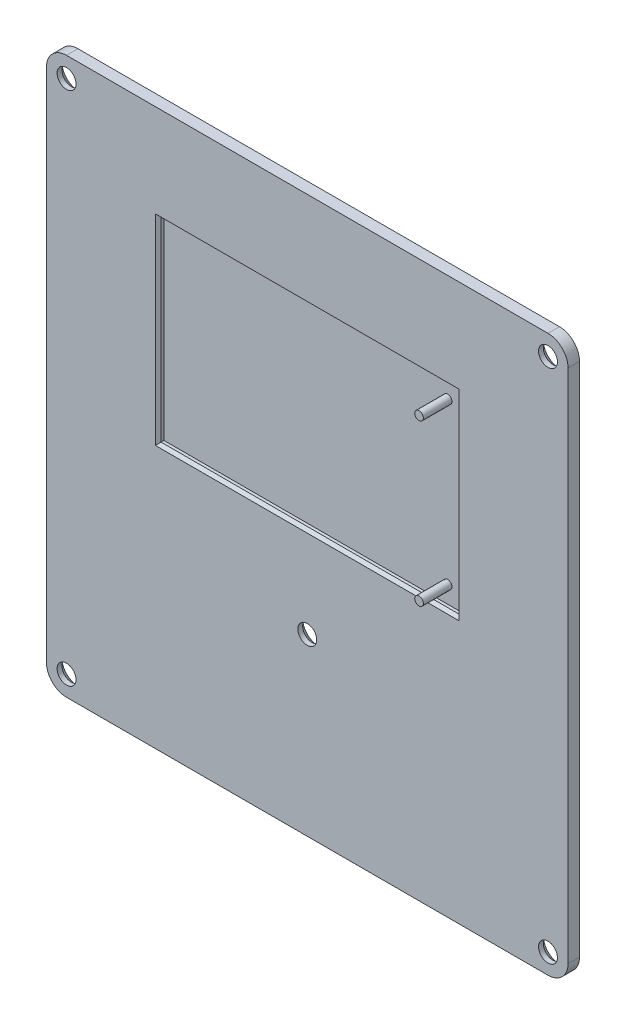
from build123d import *

# Parameters (mm, degrees)
EXTRUDE_1_DEPTH           = 2
HOLE_WIZARD_2_D           = 3.3
HOLE_WIZARD_2_DEPTH       = 15
HOLE_WIZARD_2_CSINK_D     = 5.6
HOLE_WIZARD_2_CSINK_ANGLE = 90
HOLE_WIZARD_2_TIP         = 0.991420021
SKETCH_5_W                = 0.314102564
SKETCH_5_H                = 2.557692308
EXTRUDE_3_DEPTH           = 0.2
HOLE_WIZARD_3_D           = 3.3
HOLE_WIZARD_3_DEPTH       = 15
HOLE_WIZARD_3_CSINK_D     = 5.6
HOLE_WIZARD_3_CSINK_ANGLE = 90
HOLE_WIZARD_3_TIP         = 0.991420021
SKETCH_8_W                = 52
SKETCH_8_H                = 34
CUT_EXTRUDE_1_DEPTH       = 1
CHAMFER_1_SIZE            = 0.5
SKETCH_9_R                = 0.75
EXTRUDE_4_DEPTH           = 5


with BuildPart() as part:
    # 草图1 → 凸台-拉伸1 (new body)
    with BuildSketch(Plane.XY):
        with BuildLine():
            Line((-42, 48.5), (42, 48.5))
            ThreePointArc((42, 48.5), (44.474873734, 47.474873734), (45.5, 45))
            Line((45.5, 45), (45.5, -45))
            ThreePointArc((45.5, -45), (44.474873734, -47.474873734), (42, -48.5))
            Line((42, -48.5), (-42, -48.5))
            ThreePointArc((-42, -48.5), (-44.474873734, -47.474873734), (-45.5, -45))
            Line((-45.5, -45), (-45.5, 45))
            ThreePointArc((-45.5, 45), (-44.474873734, 47.474873734), (-42, 48.5))
        make_face()
    extrude(amount=-EXTRUDE_1_DEPTH)

    # 打孔尺寸开槽半沉头螺钉的类型2
    with Locations(Plane(origin=(42, 45, -2), x_dir=(-1, 0, 0), z_dir=(0, 0, -1))):
        with Locations((0, 0), (84, 0), (84, -90), (0, -90)):
            CounterSinkHole(HOLE_WIZARD_2_D / 2, HOLE_WIZARD_2_CSINK_D / 2, depth=HOLE_WIZARD_2_DEPTH, counter_sink_angle=HOLE_WIZARD_2_CSINK_ANGLE)
            with Locations((0, 0, -(HOLE_WIZARD_2_DEPTH + HOLE_WIZARD_2_TIP / 2))):  # 118° drill point
                Cone(0, HOLE_WIZARD_2_D / 2, HOLE_WIZARD_2_TIP, mode=Mode.SUBTRACT)

    # 草图5 → 凸台-拉伸3 (add)
    # profile 1 of 6: a face of its own
    with BuildSketch(Plane(origin=(0, 0, -2), x_dir=(-1, 0, 0), z_dir=(0, 0, -1))):
        with BuildLine():
            Line((-6.136904816, 34.351745916), (-5.436484142, 34.351745916))
            add(Edge.make_bspline(
                [(-5.436484142, 34.351745916), (-5.389743014, 34.35159033), (-5.29999487, 34.351291588), (-5.171421599, 34.349625825), (-5.054594502, 34.344851469), (-4.949574663, 34.340742886), (-4.856364008, 34.333250944), (-4.774676717, 34.326090297), (-4.70488902, 34.316716636), (-4.662643168, 34.308011213), (-4.643515392, 34.304069634)],
                knots=[0, 0, 0, 0, 1.410062039, 2.707475311, 3.878576406, 4.937260626, 5.877586885, 6.699081471, 7.410979367, 8, 8, 8, 8], degree=3))
            add(Edge.make_bspline(
                [(-4.643515392, 34.304069634), (-4.617908768, 34.297742869), (-4.567241779, 34.285224305), (-4.494291713, 34.258764704), (-4.424777389, 34.22814508), (-4.358987565, 34.192181359), (-4.297251773, 34.15060658), (-4.238933463, 34.104138457), (-4.183767999, 34.053031251), (-4.133986369, 33.99599641), (-4.087047317, 33.9361599), (-4.047458691, 33.871456143), (-4.013332211, 33.803794616), (-3.986161694, 33.732487198), (-3.964283721, 33.658225426), (-3.948857481, 33.580336629), (-3.939606294, 33.499175654), (-3.938664438, 33.443817746), (-3.938186867, 33.41574832)],
                knots=[0, 0, 0, 0, 1.027469482, 2.033020251, 3.019912614, 3.986113645, 4.951240523, 5.91722682, 6.890402269, 7.87763091, 8.8651537, 9.85103654, 10.82876324, 11.815024772, 12.821070561, 13.842952187, 14.906261191, 16, 16, 16, 16], degree=3))
            add(Edge.make_bspline(
                [(-3.938186867, 33.41574832), (-3.939655865, 33.369113215), (-3.942522261, 33.278116047), (-3.969247364, 33.146055166), (-4.013023884, 33.022865851), (-4.073347173, 32.908703213), (-4.150166649, 32.805792568), (-4.24249144, 32.715402113), (-4.350373051, 32.6397622), (-4.450802367, 32.587309395), (-4.539516567, 32.553716487), (-4.61254988, 32.530080128), (-4.692216857, 32.511818163), (-4.777754192, 32.495458031), (-4.869517847, 32.483106337), (-4.967287887, 32.474059742), (-5.071134039, 32.468405693), (-5.142473108, 32.467563688), (-5.179172444, 32.467130531)],
                knots=[0, 0, 0, 0, 1.260483769, 2.459530307, 3.627416485, 4.787058657, 5.939039949, 7.08810263, 8.267026773, 9.491475466, 10.141966685, 10.831826277, 11.566392101, 12.351337768, 13.187381173, 14.07005841, 15.007169909, 16, 16, 16, 16], degree=3))
            Line((-5.179172444, 32.467130531), (-3.893315072, 30.851745916))
            Line((-3.893315072, 30.851745916), (-4.281736546, 30.851745916))
            Line((-4.281736546, 30.851745916), (-5.567593918, 32.467130531))
            Line((-5.567593918, 32.467130531), (-5.822802251, 32.467130531))
            Line((-5.822802251, 32.467130531), (-5.822802251, 30.851745916))
            Line((-5.822802251, 30.851745916), (-6.136904816, 30.851745916))
            Line((-6.136904816, 30.851745916), (-6.136904816, 34.351745916))
        make_face()
        with BuildLine():
            Line((-5.822802251, 33.992771557), (-5.822802251, 32.82610489))
            Line((-5.822802251, 32.82610489), (-5.181976931, 32.821197038))
            add(Edge.make_bspline(
                [(-5.181976931, 32.821197038), (-5.152056892, 32.821183801), (-5.094063335, 32.821158145), (-5.01016267, 32.825151921), (-4.932042558, 32.829695239), (-4.860001806, 32.836644585), (-4.794008231, 32.845600657), (-4.734094818, 32.856803641), (-4.680163766, 32.869855703), (-4.617265227, 32.890057329), (-4.547028696, 32.922063348), (-4.470697236, 32.968628846), (-4.405694898, 33.027197965), (-4.350777036, 33.094171421), (-4.306647605, 33.16780767), (-4.27553555, 33.247224039), (-4.255793108, 33.330415637), (-4.253464563, 33.387593745), (-4.252289431, 33.416449442)],
                knots=[0, 0, 0, 0, 1.146690395, 2.22261258, 3.21895312, 4.145990853, 4.996080663, 5.770904154, 6.481378293, 7.121626537, 8.300444488, 9.431385265, 10.535395872, 11.636531494, 12.74115979, 13.810798291, 14.895190096, 16, 16, 16, 16], degree=3))
            add(Edge.make_bspline(
                [(-4.252289431, 33.416449442), (-4.253491552, 33.444596015), (-4.255873717, 33.500372254), (-4.275322486, 33.582028164), (-4.308211867, 33.659095115), (-4.352534105, 33.7312596), (-4.40653326, 33.796765335), (-4.469851073, 33.852812488), (-4.540756268, 33.899061953), (-4.607027466, 33.928616334), (-4.666261679, 33.946736187), (-4.717691339, 33.959487351), (-4.775802817, 33.96973182), (-4.840878275, 33.97793988), (-4.912639906, 33.984994825), (-4.991450557, 33.989746603), (-5.076787337, 33.992560468), (-5.135934269, 33.992699556), (-5.166552251, 33.992771557)],
                knots=[0, 0, 0, 0, 1.101028733, 2.181837193, 3.264309656, 4.369019818, 5.486613113, 6.575447106, 7.666700264, 8.788928104, 9.402425223, 10.0903467, 10.862060571, 11.710948788, 12.657782767, 13.684531032, 14.801375019, 16, 16, 16, 16], degree=3))
            Line((-5.166552251, 33.992771557), (-5.822802251, 33.992771557))
        make_face(mode=Mode.SUBTRACT)
    # profile 2 of 6: a face of its own
    with BuildSketch(Plane(origin=(0, 0, -2), x_dir=(-1, 0, 0), z_dir=(0, 0, -1))):
        with BuildLine():
            Line((-3.309981739, 33.409438224), (-2.995879175, 33.409438224))
            Line((-2.995879175, 33.409438224), (-2.995879175, 32.223140147))
            add(Edge.make_bspline(
                [(-2.995879175, 32.223140147), (-2.99573727, 32.188317398), (-2.995465812, 32.12170311), (-2.993624871, 32.025847923), (-2.989294778, 31.93843121), (-2.983880953, 31.859402473), (-2.976918817, 31.788775082), (-2.968635457, 31.726795725), (-2.959377035, 31.672761541), (-2.950314321, 31.640218185), (-2.946099527, 31.625083256)],
                knots=[0, 0, 0, 0, 1.388932606, 2.656963016, 3.823490214, 4.879454478, 5.816252168, 6.653371382, 7.373723809, 8, 8, 8, 8], degree=3))
            add(Edge.make_bspline(
                [(-2.946099527, 31.625083256), (-2.939338072, 31.606060385), (-2.925955731, 31.568410124), (-2.901682247, 31.514021119), (-2.871653911, 31.463645836), (-2.838794083, 31.415341763), (-2.800894675, 31.370539777), (-2.758435204, 31.329315533), (-2.712836967, 31.290111442), (-2.645081944, 31.24372665), (-2.552422678, 31.19401132), (-2.430769922, 31.151115501), (-2.298865697, 31.125479681), (-2.207700977, 31.122505426), (-2.160843117, 31.120976685)],
                knots=[0, 0, 0, 0, 0.725840625, 1.436591201, 2.137033971, 2.831655856, 3.53531722, 4.242432219, 4.957935707, 5.694543706, 7.190802206, 8.724350549, 10.316345118, 12, 12, 12, 12], degree=3))
            add(Edge.make_bspline(
                [(-2.160843117, 31.120976685), (-2.113989609, 31.122537934), (-2.023336741, 31.125558661), (-1.892881772, 31.1503422), (-1.773630357, 31.191747889), (-1.666779406, 31.2495553), (-1.572813566, 31.320297363), (-1.494509147, 31.403306172), (-1.429901892, 31.495955559), (-1.401692472, 31.565079838), (-1.387505777, 31.599842871)],
                knots=[0, 0, 0, 0, 1.157059328, 2.238695713, 3.266970494, 4.264342957, 5.228770407, 6.160125903, 7.074715775, 8, 8, 8, 8], degree=3))
            add(Edge.make_bspline(
                [(-1.387505777, 31.599842871), (-1.383311547, 31.61380917), (-1.374039129, 31.644685245), (-1.364076777, 31.697064994), (-1.355102316, 31.759529598), (-1.347439139, 31.832487807), (-1.341973977, 31.915748959), (-1.33902795, 32.009287035), (-1.335699675, 32.112808396), (-1.335649159, 32.185276155), (-1.335622764, 32.223140147)],
                knots=[0, 0, 0, 0, 0.557542046, 1.232589297, 2.036731608, 2.971723315, 4.038036528, 5.22795436, 6.551621927, 8, 8, 8, 8], degree=3))
            Line((-1.335622764, 32.223140147), (-1.335622764, 33.409438224))
            Line((-1.335622764, 33.409438224), (-1.0215202, 33.409438224))
            Line((-1.0215202, 33.409438224), (-1.0215202, 32.164245916))
            add(Edge.make_bspline(
                [(-1.0215202, 32.164245916), (-1.021961895, 32.121938745), (-1.022818843, 32.039857045), (-1.028326187, 31.920572933), (-1.0377758, 31.809410688), (-1.052118484, 31.706311468), (-1.068984159, 31.611353987), (-1.090740432, 31.524416541), (-1.11671867, 31.445766987), (-1.146024185, 31.37402521), (-1.180646052, 31.308978316), (-1.217473073, 31.247242499), (-1.259997845, 31.190349564), (-1.304768079, 31.135467427), (-1.354569735, 31.085325899), (-1.408469594, 31.038774423), (-1.465709014, 30.995101392), (-1.527558212, 30.956010112), (-1.593114275, 30.920793467), (-1.662458132, 30.889577389), (-1.73643913, 30.864874812), (-1.814102767, 30.843564146), (-1.895829546, 30.826849677), (-1.981540679, 30.81506311), (-2.071207295, 30.807837779), (-2.132316755, 30.807200734), (-2.163647604, 30.806874121)],
                knots=[0, 0, 0, 0, 1.493040784, 2.896703357, 4.213163133, 5.428574705, 6.569057535, 7.615249723, 8.588095153, 9.490268104, 10.346124644, 11.18633936, 12.024365274, 12.850166724, 13.684164916, 14.514361689, 15.362232829, 16.222528818, 17.093394965, 17.986930858, 18.902426812, 19.842810585, 20.827885679, 21.843828298, 22.894529745, 24, 24, 24, 24], degree=3))
            add(Edge.make_bspline(
                [(-2.163647604, 30.806874121), (-2.194744118, 30.807213828), (-2.255851663, 30.807881385), (-2.345522907, 30.815023192), (-2.431471514, 30.826831363), (-2.513391912, 30.84368658), (-2.59136631, 30.86472565), (-2.665710549, 30.889729186), (-2.735554112, 30.920809667), (-2.801736116, 30.955787225), (-2.863738505, 30.9953525), (-2.921847083, 31.03872054), (-2.975983935, 31.085826603), (-3.026161003, 31.13647396), (-3.07167398, 31.191290896), (-3.113090022, 31.249836457), (-3.151046727, 31.311530545), (-3.185399517, 31.377593708), (-3.214911273, 31.450165718), (-3.240966519, 31.530462815), (-3.262277157, 31.619365331), (-3.279619625, 31.71679726), (-3.293571066, 31.822292302), (-3.303257208, 31.936460717), (-3.308673039, 32.059024409), (-3.3095361, 32.143674299), (-3.309981739, 32.187382935)],
                knots=[0, 0, 0, 0, 1.083640291, 2.129454052, 3.13281866, 4.105697902, 5.042300162, 5.946461698, 6.836384745, 7.703652036, 8.553297018, 9.397182691, 10.228592656, 11.052265423, 11.879314572, 12.708807002, 13.549817954, 14.402308542, 15.300838682, 16.27712199, 17.341985831, 18.484375296, 19.725102775, 21.0496083, 22.476576903, 24, 24, 24, 24], degree=3))
            Line((-3.309981739, 32.187382935), (-3.309981739, 33.409438224))
        make_face()
    # profile 3 of 6: a face of its own
    with BuildSketch(Plane(origin=(0, 0, -2), x_dir=(-1, 0, 0), z_dir=(0, 0, -1))):
        with BuildLine():
            add(Edge.make_bspline(
                [(-0.192794239, 34.486361301), (-0.173302923, 34.485457148), (-0.135135183, 34.483686644), (-0.079941915, 34.468525167), (-0.029684903, 34.442825482), (0.01489283, 34.408345801), (0.053144716, 34.367796357), (0.079925427, 34.320535389), (0.097137823, 34.26947675), (0.099216378, 34.233861661), (0.100274672, 34.215728288)],
                knots=[0, 0, 0, 0, 1.055194115, 2.066272739, 3.074728998, 4.095836921, 5.109056067, 6.073838105, 7.019297344, 8, 8, 8, 8], degree=3))
            add(Edge.make_bspline(
                [(0.100274672, 34.215728288), (0.099192512, 34.198065635), (0.09705321, 34.16314866), (0.079938722, 34.112975188), (0.052916484, 34.066370904), (0.014917358, 34.025900194), (-0.029691403, 33.991439574), (-0.079940189, 33.965734835), (-0.135135637, 33.950574698), (-0.173303076, 33.948804009), (-0.192794239, 33.947899762)],
                knots=[0, 0, 0, 0, 0.96129708, 1.900370562, 2.859976407, 3.87933698, 4.906634145, 5.921202961, 6.938410037, 8, 8, 8, 8], degree=3))
            add(Edge.make_bspline(
                [(-0.192794239, 33.947899762), (-0.212062514, 33.948769482), (-0.249565694, 33.950462279), (-0.303932536, 33.966032297), (-0.353761026, 33.99144837), (-0.398425698, 34.025674555), (-0.435655891, 34.066619452), (-0.462754217, 34.112946746), (-0.479829179, 34.163155901), (-0.481973807, 34.198068067), (-0.483058662, 34.215728288)],
                knots=[0, 0, 0, 0, 1.054934014, 2.053291228, 3.073705704, 4.106921865, 5.123545215, 6.088680038, 7.033164197, 8, 8, 8, 8], degree=3))
            add(Edge.make_bspline(
                [(-0.483058662, 34.215728288), (-0.481997575, 34.233859137), (-0.479913534, 34.26946927), (-0.462741418, 34.320564303), (-0.43588161, 34.367545805), (-0.398401047, 34.408571304), (-0.353767586, 34.442816739), (-0.303930841, 34.46822772), (-0.249566142, 34.48379906), (-0.212062666, 34.485491674), (-0.192794239, 34.486361301)],
                knots=[0, 0, 0, 0, 0.98631895, 1.937192651, 2.907499808, 3.917963147, 4.944918757, 5.95915025, 6.951458133, 8, 8, 8, 8], degree=3))
        make_face()
    # profile 4 of 6: a face of its own
    with BuildSketch(Plane(origin=(0, 0, -2), x_dir=(-1, 0, 0), z_dir=(0, 0, -1))):
        with Locations((-0.191391995, 32.13059207)):
            Rectangle(SKETCH_5_W, SKETCH_5_H)
    # profile 5 of 6: a face of its own
    with BuildSketch(Plane(origin=(0, 0, -2), x_dir=(-1, 0, 0), z_dir=(0, 0, -1))):
        with BuildLine():
            Line((2.972069543, 33.409438224), (3.286172108, 33.409438224))
            Line((3.286172108, 33.409438224), (3.286172108, 31.379690628))
            add(Edge.make_bspline(
                [(3.286172108, 31.379690628), (3.285895065, 31.336453033), (3.285360306, 31.25299406), (3.281509335, 31.132315781), (3.273388658, 31.020849695), (3.264179976, 30.918087437), (3.25093326, 30.824505326), (3.234756893, 30.739824122), (3.216521214, 30.663962559), (3.200500996, 30.617237718), (3.192922909, 30.595135339)],
                knots=[0, 0, 0, 0, 1.307562039, 2.523909702, 3.650326591, 4.686913197, 5.643429486, 6.506965704, 7.293745905, 8, 8, 8, 8], degree=3))
            add(Edge.make_bspline(
                [(3.192922909, 30.595135339), (3.18173367, 30.566405418), (3.159689744, 30.509804581), (3.11840411, 30.42957026), (3.072170207, 30.35402387), (3.019363456, 30.283586419), (2.960222652, 30.218611506), (2.89614116, 30.157687507), (2.825870968, 30.10210334), (2.749452256, 30.052818042), (2.668646623, 30.008430988), (2.583500521, 29.969984421), (2.494494082, 29.936497577), (2.400791191, 29.911414781), (2.303860956, 29.889680061), (2.202563525, 29.875535375), (2.097490729, 29.865908317), (2.026045348, 29.865018084), (1.989797909, 29.864566429)],
                knots=[0, 0, 0, 0, 0.981931301, 1.934503488, 2.87077864, 3.801706999, 4.735015492, 5.667491629, 6.616593066, 7.585388521, 8.561939025, 9.551802639, 10.560317337, 11.588439944, 12.640189604, 13.723962949, 14.845264515, 16, 16, 16, 16], degree=3))
            add(Edge.make_bspline(
                [(1.989797909, 29.864566429), (1.936913174, 29.865422915), (1.833615079, 29.867095862), (1.683010086, 29.886586777), (1.539975366, 29.91414115), (1.40640091, 29.955846577), (1.283130813, 30.006883567), (1.171006937, 30.06547852), (1.07103583, 30.132667829), (0.980912157, 30.20916843), (0.899570567, 30.300132111), (0.823043277, 30.407330956), (0.749382335, 30.532397845), (0.706213697, 30.624190558), (0.683608005, 30.672258737)],
                knots=[0, 0, 0, 0, 1.157897085, 2.2616841, 3.32207898, 4.345638746, 5.321241055, 6.241986252, 7.112515963, 7.955008012, 8.825025602, 9.77857164, 10.836726669, 12, 12, 12, 12], degree=3))
            Line((0.683608005, 30.672258737), (0.997710569, 30.672258737))
            add(Edge.make_bspline(
                [(0.997710569, 30.672258737), (1.022972778, 30.632152861), (1.072357287, 30.553750812), (1.164705768, 30.452237656), (1.265912094, 30.365484292), (1.379391777, 30.295573518), (1.505616993, 30.242863726), (1.644663679, 30.20528843), (1.797663301, 30.182792163), (1.904181515, 30.180080869), (1.959649672, 30.178668993)],
                knots=[0, 0, 0, 0, 0.997731894, 1.950442991, 2.880492273, 3.800895997, 4.748200782, 5.754801363, 6.83083817, 8, 8, 8, 8], degree=3))
            add(Edge.make_bspline(
                [(1.959649672, 30.178668993), (2.014416562, 30.180099142), (2.120001645, 30.182856326), (2.271832814, 30.20529847), (2.410427752, 30.242871903), (2.534987952, 30.29548029), (2.644043721, 30.359930696), (2.738055712, 30.431930771), (2.814200388, 30.513111774), (2.865413355, 30.58789358), (2.897247973, 30.654517709), (2.917520209, 30.711870305), (2.933994179, 30.776723183), (2.947774016, 30.848858919), (2.95914493, 30.928380576), (2.966347812, 31.01546998), (2.971553624, 31.109929202), (2.971893593, 31.17542234), (2.972069543, 31.209318031)],
                knots=[0, 0, 0, 0, 1.570740765, 3.028230971, 4.391408896, 5.680370741, 6.894727393, 8.017376726, 9.065722033, 10.075533815, 10.603371122, 11.180248986, 11.817768598, 12.521299649, 13.286540596, 14.121245857, 15.027658897, 16, 16, 16, 16], degree=3))
            Line((2.972069543, 31.209318031), (2.972069543, 31.341830051))
            add(Edge.make_bspline(
                [(2.972069543, 31.341830051), (2.940188426, 31.303888249), (2.87698697, 31.228672029), (2.767839643, 31.130110392), (2.648622728, 31.045224262), (2.519539185, 30.975605627), (2.383750943, 30.919924203), (2.242728713, 30.880981242), (2.097736657, 30.855821342), (1.999484508, 30.853114026), (1.949833966, 30.851745916)],
                knots=[0, 0, 0, 0, 1.012485704, 2.007162095, 2.997754123, 3.998611389, 4.999708251, 5.992315798, 6.98544096, 8, 8, 8, 8], degree=3))
            add(Edge.make_bspline(
                [(1.949833966, 30.851745916), (1.920597697, 30.852260943), (1.86247114, 30.853284901), (1.776116392, 30.862243678), (1.691035954, 30.87524242), (1.60742825, 30.894323859), (1.525172637, 30.918815586), (1.444405045, 30.949432325), (1.364471519, 30.984047443), (1.286825021, 31.024820246), (1.21223889, 31.070182553), (1.141275705, 31.119321444), (1.074307166, 31.171979732), (1.011970676, 31.228676672), (0.954348005, 31.289330205), (0.900664137, 31.353293758), (0.85180679, 31.421460499), (0.8067734, 31.492587457), (0.76771585, 31.56714838), (0.733431478, 31.643526476), (0.703622073, 31.72155843), (0.679856672, 31.801505493), (0.661705558, 31.883317262), (0.648195331, 31.966859711), (0.6405324, 32.052390098), (0.639337476, 32.110011448), (0.63873621, 32.139005531)],
                knots=[0, 0, 0, 0, 1.028754217, 2.045334182, 3.052854819, 4.056607503, 5.061168794, 6.071104265, 7.095078842, 8.125279047, 9.155117945, 10.165957491, 11.161587969, 12.151493252, 13.128948131, 14.104219989, 15.088194871, 16.07871515, 17.064853787, 18.047899887, 19.02414258, 20.002704429, 20.980574569, 21.971845993, 22.979467364, 24, 24, 24, 24], degree=3))
            add(Edge.make_bspline(
                [(0.63873621, 32.139005531), (0.639255376, 32.168008627), (0.640291698, 32.225902486), (0.649242677, 32.311781872), (0.662010867, 32.396511307), (0.682218636, 32.479217449), (0.706541158, 32.5608422), (0.736664731, 32.640782657), (0.77288349, 32.719063166), (0.81389324, 32.795741697), (0.859977333, 32.869789312), (0.910509813, 32.940115958), (0.965551688, 33.00620413), (1.024343603, 33.068720552), (1.08760342, 33.127062045), (1.155298413, 33.18108701), (1.226761293, 33.231701036), (1.302213543, 33.277812373), (1.380490931, 33.31859462), (1.459604749, 33.355807217), (1.540602984, 33.385341336), (1.621975524, 33.411364435), (1.705155438, 33.429799631), (1.789122832, 33.444021873), (1.87416517, 33.452686594), (1.931118065, 33.453768179), (1.959649672, 33.454310019)],
                knots=[0, 0, 0, 0, 1.008818848, 2.013730394, 3.001654427, 3.987803273, 4.973046549, 5.963777569, 6.957074694, 7.972068341, 8.987420212, 9.989399531, 10.982630087, 11.977756091, 12.973280677, 13.973972381, 14.989194003, 16.018387222, 17.047741039, 18.059210846, 19.057554164, 20.045176975, 21.029480261, 22.018708529, 23.007435371, 24, 24, 24, 24], degree=3))
            add(Edge.make_bspline(
                [(1.959649672, 33.454310019), (2.006700611, 33.452953345), (2.099611758, 33.450274332), (2.23634276, 33.429253187), (2.368285, 33.395739174), (2.496183016, 33.347723543), (2.621078667, 33.282173505), (2.742560322, 33.195830557), (2.860979456, 33.087920217), (2.934057287, 33.005167353), (2.972069543, 32.962122519)],
                knots=[0, 0, 0, 0, 0.96728863, 1.910097829, 2.838038873, 3.762875196, 4.71315279, 5.730631239, 6.819562287, 8, 8, 8, 8], degree=3))
            Line((2.972069543, 32.962122519), (2.972069543, 33.409438224))
        make_face()
        with BuildLine():
            add(Edge.make_bspline(
                [(1.984890056, 33.140207455), (1.938959352, 33.138646389), (1.848026298, 33.13555581), (1.714737955, 33.109171097), (1.586061022, 33.067825197), (1.464455594, 33.008682582), (1.350548484, 32.936588344), (1.249473663, 32.849248056), (1.161068747, 32.749501859), (1.086285809, 32.638251612), (1.026754443, 32.518229337), (0.984611023, 32.391718603), (0.957361, 32.26076361), (0.954353348, 32.171391007), (0.952838774, 32.126385339)],
                knots=[0, 0, 0, 0, 1.026226791, 2.031711442, 3.026614839, 4.04107745, 5.047145931, 6.032893242, 7.017642609, 8.019221815, 9.021877557, 10.003543541, 10.994637589, 12, 12, 12, 12], degree=3))
            add(Edge.make_bspline(
                [(0.952838774, 32.126385339), (0.953564531, 32.092452067), (0.954991882, 32.025715243), (0.96871546, 31.927777348), (0.990896425, 31.834497034), (1.022333632, 31.74586866), (1.061286327, 31.661383865), (1.110278698, 31.58162463), (1.167929669, 31.506519924), (1.233788007, 31.436625242), (1.306364389, 31.372964274), (1.385083588, 31.317026233), (1.469838838, 31.271275512), (1.558545648, 31.231734675), (1.653356404, 31.202855607), (1.75290549, 31.180816828), (1.857897187, 31.16820807), (1.929468926, 31.166645272), (1.965959768, 31.16584848)],
                knots=[0, 0, 0, 0, 1.039728707, 2.044842319, 3.024901384, 3.974314358, 4.923051295, 5.871625912, 6.837440708, 7.820715446, 8.810779094, 9.792721783, 10.773906224, 11.758876063, 12.764959493, 13.806266761, 14.881525401, 16, 16, 16, 16], degree=3))
            add(Edge.make_bspline(
                [(1.965959768, 31.16584848), (2.002923526, 31.166616089), (2.075205763, 31.168117141), (2.1807767, 31.181020639), (2.28080944, 31.201842615), (2.375212263, 31.231405641), (2.464341604, 31.269127391), (2.547196218, 31.316864009), (2.625552666, 31.371228441), (2.696909076, 31.434640455), (2.761433241, 31.50452545), (2.817664008, 31.580570345), (2.865578457, 31.661630864), (2.905256127, 31.74769787), (2.935547331, 31.839440223), (2.955866236, 31.936628579), (2.970072981, 32.038797318), (2.971393906, 32.108805934), (2.972069543, 32.144614506)],
                knots=[0, 0, 0, 0, 1.121943988, 2.193949579, 3.223793937, 4.220241907, 5.192961521, 6.155822191, 7.11847367, 8.083710714, 9.04790392, 10.001595906, 10.949595423, 11.902125208, 12.873731292, 13.87582262, 14.913508608, 16, 16, 16, 16], degree=3))
            add(Edge.make_bspline(
                [(2.972069543, 32.144614506), (2.970729975, 32.19123236), (2.96811293, 32.282307265), (2.943415772, 32.415014033), (2.903595562, 32.539782707), (2.84774881, 32.656218682), (2.777766801, 32.763088232), (2.693475952, 32.858412077), (2.596329922, 32.942312933), (2.486607821, 33.012211127), (2.368560376, 33.068676561), (2.24503918, 33.111038333), (2.116227616, 33.135032648), (2.028921207, 33.138472592), (1.984890056, 33.140207455)],
                knots=[0, 0, 0, 0, 1.070913519, 2.092188694, 3.091357305, 4.074328408, 5.051968682, 6.018948707, 6.99050112, 7.9935919, 9.000589572, 9.992915277, 10.987769056, 12, 12, 12, 12], degree=3))
        make_face(mode=Mode.SUBTRACT)
    # profile 6 of 6: a face of its own
    with BuildSketch(Plane(origin=(0, 0, -2), x_dir=(-1, 0, 0), z_dir=(0, 0, -1))):
        with BuildLine():
            Line((6.103279479, 31.659438224), (6.382325954, 31.512903769))
            add(Edge.make_bspline(
                [(6.382325954, 31.512903769), (6.360089358, 31.473460437), (6.31682575, 31.396719335), (6.242425002, 31.291287474), (6.164432929, 31.196439758), (6.079328961, 31.114710104), (5.989659283, 31.043458719), (5.894926628, 30.981120894), (5.79463781, 30.928002374), (5.688788085, 30.883249846), (5.576488534, 30.848840352), (5.457467018, 30.824536131), (5.331495522, 30.809512862), (5.245149342, 30.807767722), (5.200935729, 30.806874121)],
                knots=[0, 0, 0, 0, 1.120438281, 2.179929193, 3.190490725, 4.156257408, 5.095198341, 6.022838206, 6.959905092, 7.901321166, 8.864066838, 9.862729781, 10.905609505, 12, 12, 12, 12], degree=3))
            add(Edge.make_bspline(
                [(5.200935729, 30.806874121), (5.151793752, 30.808021297), (5.05593199, 30.810259103), (4.916392243, 30.829551568), (4.785012825, 30.861023926), (4.661801121, 30.904989468), (4.547058869, 30.962416792), (4.440558014, 31.032376274), (4.341738488, 31.114508528), (4.253714279, 31.209524972), (4.174470396, 31.311206929), (4.104544576, 31.417162814), (4.046087145, 31.527126038), (3.998534535, 31.640396562), (3.96012967, 31.756260456), (3.933362966, 31.875771923), (3.917933218, 31.998607508), (3.915568773, 32.081704843), (3.914377236, 32.123580852)],
                knots=[0, 0, 0, 0, 1.145258523, 2.234067595, 3.276747158, 4.290159414, 5.277019952, 6.260822364, 7.254936242, 8.264827045, 9.274100331, 10.257902744, 11.220704747, 12.172965371, 13.118907548, 14.062713208, 15.023725156, 16, 16, 16, 16], degree=3))
            add(Edge.make_bspline(
                [(3.914377236, 32.123580852), (3.915436377, 32.162875682), (3.917535455, 32.240752847), (3.930766243, 32.356018392), (3.954214536, 32.468046844), (3.98639086, 32.576931292), (4.027942106, 32.682489426), (4.078774325, 32.78478549), (4.138966703, 32.88371063), (4.185439377, 32.946113763), (4.20884839, 32.977547198)],
                knots=[0, 0, 0, 0, 1.024358464, 2.0301432, 3.019427413, 4.004406732, 4.986367066, 5.972626655, 6.978780325, 8, 8, 8, 8], degree=3))
            add(Edge.make_bspline(
                [(4.20884839, 32.977547198), (4.240556072, 33.015416068), (4.302967019, 33.089954219), (4.408523374, 33.187892544), (4.522823571, 33.26993632), (4.644435197, 33.337943456), (4.774771671, 33.389617103), (4.912080962, 33.428124685), (5.057926548, 33.449702696), (5.157631769, 33.45275053), (5.208648069, 33.454310019)],
                knots=[0, 0, 0, 0, 1.030682036, 2.02871468, 2.997146059, 3.962720338, 4.930598197, 5.918074684, 6.934738563, 8, 8, 8, 8], degree=3))
            add(Edge.make_bspline(
                [(5.208648069, 33.454310019), (5.261095674, 33.45295597), (5.36398592, 33.450299634), (5.514018041, 33.425673301), (5.655978758, 33.386620747), (5.789811262, 33.331466956), (5.915529123, 33.260307404), (6.032315173, 33.172165563), (6.142166685, 33.069747476), (6.206075264, 32.990984266), (6.238595986, 32.95090457)],
                knots=[0, 0, 0, 0, 1.056321875, 2.072262726, 3.055038591, 4.01806755, 4.982017516, 5.957941055, 6.960871419, 8, 8, 8, 8], degree=3))
            add(Edge.make_bspline(
                [(6.238595986, 32.95090457), (6.260722924, 32.920700989), (6.304829517, 32.86049487), (6.360076617, 32.762323713), (6.408034012, 32.659613118), (6.446366973, 32.550702821), (6.477406474, 32.436883241), (6.499863293, 32.317340696), (6.513032912, 32.192110785), (6.515621609, 32.10678423), (6.516941338, 32.063284378)],
                knots=[0, 0, 0, 0, 0.94817472, 1.890038105, 2.849395472, 3.817997239, 4.812318967, 5.836947057, 6.897266129, 8, 8, 8, 8], degree=3))
            Line((6.516941338, 32.063284378), (4.2284798, 32.063284378))
            add(Edge.make_bspline(
                [(4.2284798, 32.063284378), (4.230019406, 32.029583913), (4.23304698, 31.96331331), (4.247162123, 31.866342527), (4.269410897, 31.773969184), (4.30067996, 31.686886142), (4.338546805, 31.603956015), (4.384932522, 31.525793978), (4.440272076, 31.452756048), (4.501997775, 31.38418891), (4.57070487, 31.323128149), (4.642987618, 31.268476373), (4.719881183, 31.222670776), (4.800779266, 31.185490886), (4.885551051, 31.15638457), (4.974223246, 31.13651675), (5.066621363, 31.123209643), (5.129607097, 31.121729978), (5.161672909, 31.120976685)],
                knots=[0, 0, 0, 0, 1.094153842, 2.151609401, 3.174256925, 4.172055639, 5.149267565, 6.128595816, 7.11444997, 8.118368179, 9.117203808, 10.09244225, 11.054858984, 12.015122123, 12.976791628, 13.957293641, 14.960065497, 16, 16, 16, 16], degree=3))
            add(Edge.make_bspline(
                [(5.161672909, 31.120976685), (5.193024056, 31.121584742), (5.255230747, 31.122791243), (5.347871605, 31.134523154), (5.439011132, 31.15349343), (5.528272115, 31.17938342), (5.613842961, 31.210960272), (5.693088511, 31.249063129), (5.765968727, 31.291212876), (5.834085694, 31.339422551), (5.900156687, 31.398430738), (5.965699173, 31.472066459), (6.035975827, 31.559153987), (6.079965419, 31.624699653), (6.103279479, 31.659438224)],
                knots=[0, 0, 0, 0, 0.99110716, 1.966546729, 2.947904876, 3.932708344, 4.903319531, 5.828989031, 6.710028674, 7.56322171, 8.463672341, 9.504779593, 10.677557249, 12, 12, 12, 12], degree=3))
        make_face()
        with BuildLine():
            add(Edge.make_bspline(
                [(6.202838774, 32.377386942), (6.19134215, 32.419049815), (6.169214848, 32.499237436), (6.122978484, 32.610278326), (6.070906943, 32.708966227), (6.009285212, 32.794545861), (5.939466486, 32.870549374), (5.858821303, 32.936967959), (5.76838541, 32.99638541), (5.668626269, 33.046537909), (5.562984484, 33.089227768), (5.452378292, 33.117852884), (5.339520504, 33.137462426), (5.263186218, 33.139288534), (5.22477387, 33.140207455)],
                knots=[0, 0, 0, 0, 1.154881502, 2.222775134, 3.210006277, 4.132804581, 5.035138423, 5.962687519, 6.919655026, 7.923214229, 8.944639381, 9.960483929, 10.97369054, 12, 12, 12, 12], degree=3))
            add(Edge.make_bspline(
                [(5.22477387, 33.140207455), (5.193424432, 33.139595783), (5.131453183, 33.138386637), (5.040152115, 33.126916508), (4.952472416, 33.107956663), (4.867767128, 33.081991706), (4.78714626, 33.047383104), (4.708951491, 33.006799877), (4.635171095, 32.957258293), (4.5890298, 32.919499438), (4.565719383, 32.900423801)],
                knots=[0, 0, 0, 0, 1.04873581, 2.073130211, 3.073294108, 4.04793562, 5.032784715, 6.005352987, 6.992311501, 8, 8, 8, 8], degree=3))
            add(Edge.make_bspline(
                [(4.565719383, 32.900423801), (4.549026101, 32.885329485), (4.515242967, 32.854782269), (4.470102445, 32.802153062), (4.426881973, 32.7454015), (4.38754832, 32.682356376), (4.351470734, 32.613735597), (4.317710756, 32.540117961), (4.287324344, 32.460944831), (4.270228234, 32.405772392), (4.261432524, 32.377386942)],
                knots=[0, 0, 0, 0, 0.879870761, 1.780643979, 2.707998968, 3.669668524, 4.684282772, 5.740141944, 6.837334558, 8, 8, 8, 8], degree=3))
            Line((4.261432524, 32.377386942), (6.202838774, 32.377386942))
        make_face(mode=Mode.SUBTRACT)
    extrude(amount=EXTRUDE_3_DEPTH)

    # 打孔尺寸开槽半沉头螺钉的类型3
    with Locations(Plane(origin=(0, -18, -2), x_dir=(-1, 0, 0), z_dir=(0, 0, -1))):
        with Locations((0, 0)):
            CounterSinkHole(HOLE_WIZARD_3_D / 2, HOLE_WIZARD_3_CSINK_D / 2, depth=HOLE_WIZARD_3_DEPTH, counter_sink_angle=HOLE_WIZARD_3_CSINK_ANGLE)
            with Locations((0, 0, -(HOLE_WIZARD_3_DEPTH + HOLE_WIZARD_3_TIP / 2))):  # 118° drill point
                Cone(0, HOLE_WIZARD_3_D / 2, HOLE_WIZARD_3_TIP, mode=Mode.SUBTRACT)

    # 草图8 → 切除-拉伸1 (cut)
    with BuildSketch(Plane.XY):
        with Locations((0, 14.808401639)):
            Rectangle(SKETCH_8_W, SKETCH_8_H)
    extrude(amount=-CUT_EXTRUDE_1_DEPTH, mode=Mode.SUBTRACT)

    # 倒角1
    chamfer_1_edges = [part.edges().sort_by_distance(p)[0] for p in [
        (26, 14.808401639, 0),
        (0, 31.808401639, 0),
        (-26, 14.808401639, 0),
        (0, -2.191598361, 0),
    ]]
    chamfer(chamfer_1_edges, length=CHAMFER_1_SIZE)

    # 草图9 → 凸台-拉伸4 (add)
    with BuildSketch(Plane.XY.offset(-1)):
        with Locations((23.5, 28.808401639)):
            Circle(SKETCH_9_R)
        with Locations(Location((23.5, 0.808401639, 0), (0, 0, 180))):
            Circle(SKETCH_9_R)
    extrude(amount=EXTRUDE_4_DEPTH)


solid = part.part
